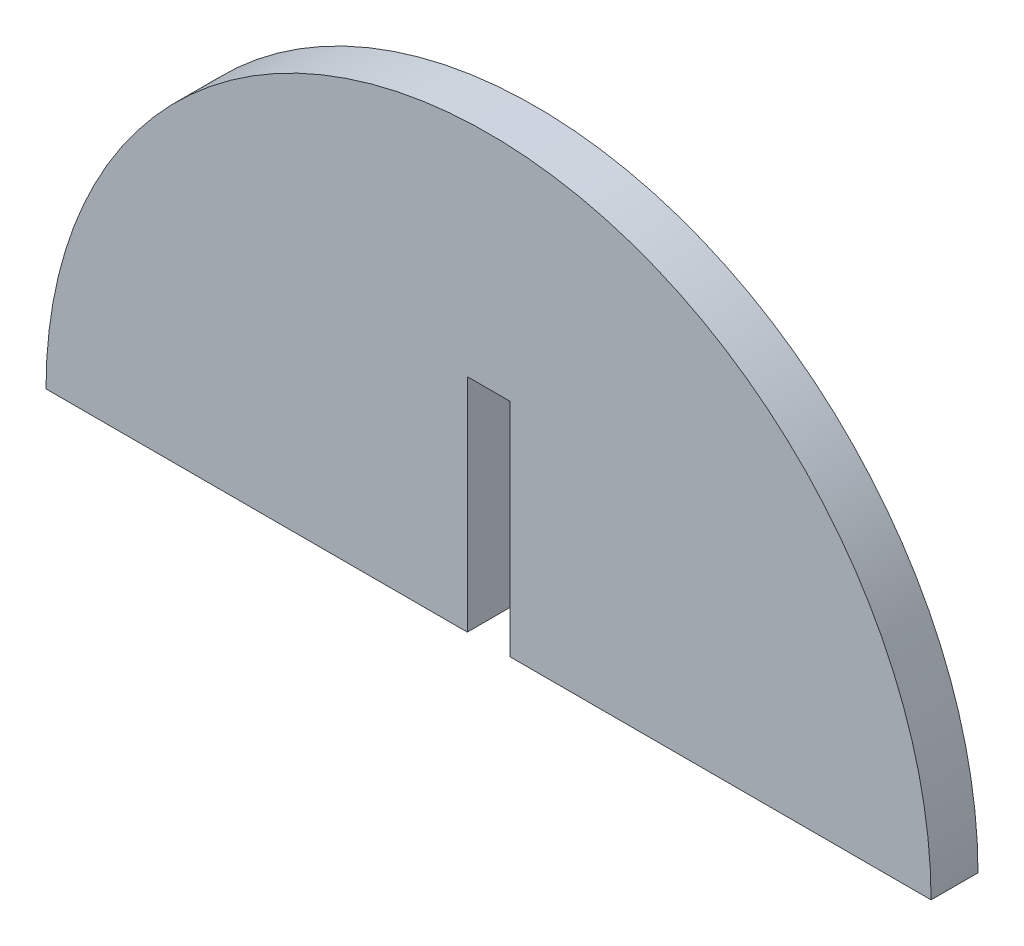
from build123d import *

# Parameters (mm, degrees)
BOSS_EXTRUDE1_DEPTH = 2.6924


with BuildPart() as part:
    # Sketch1 → Boss-Extrude1 (new body)
    with BuildSketch(Plane.XY):
        with BuildLine():
            Line((-25.4, 0), (-1.2192, 0))
            Line((-1.2192, 0), (-1.2192, 12.7))
            Line((-1.2192, 12.7), (1.2192, 12.7))
            Line((1.2192, 12.7), (1.2192, 0))
            Line((1.2192, 0), (25.4, 0))
            ThreePointArc((25.4, 0), (0, 25.4), (-25.4, 0))
        make_face()
    extrude(amount=BOSS_EXTRUDE1_DEPTH)


solid = part.part
